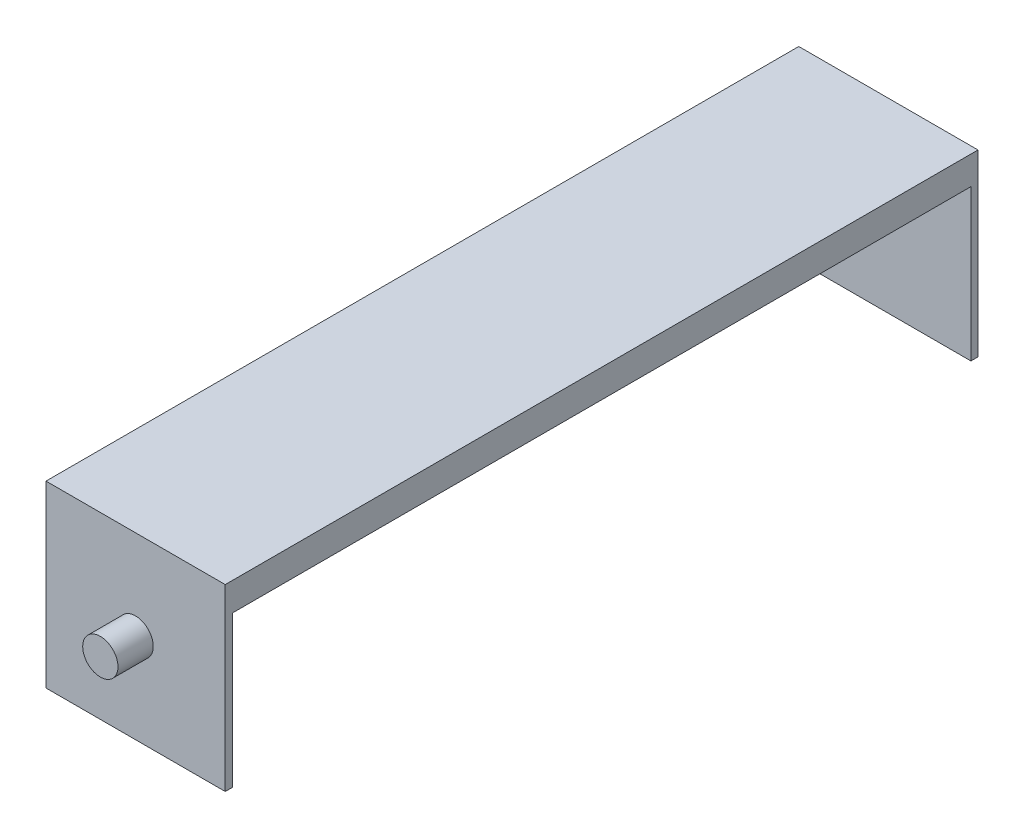
from build123d import *

# Parameters (mm, degrees)
SKETCH1_W           = 254
SKETCH1_H           = 254
BOSS_EXTRUDE1_DEPTH = 533.4
SKETCH2_R           = 25
BOSS_EXTRUDE2_DEPTH = 50
SKETCH3_W           = 1046.8
SKETCH3_H           = 267.639830062
CUT_EXTRUDE1_DEPTH  = 254


with BuildPart() as part:
    # Sketch1 → Boss-Extrude1 (new, symmetric)
    with BuildSketch(Plane.XY):
        Rectangle(SKETCH1_W, SKETCH1_H)
    extrude(amount=BOSS_EXTRUDE1_DEPTH, both=True)

    # Sketch2 → Boss-Extrude2 (add)
    with BuildSketch(Plane.XY.offset(533.4)):
        with Locations(Location((0, 0, 0), (0, 0, 180))):
            Circle(SKETCH2_R)
    boss_extrude2 = extrude(amount=BOSS_EXTRUDE2_DEPTH)

    # Mirror1: Boss-Extrude2 across plane
    add(boss_extrude2.mirror(Plane.XY))

    # Sketch3 → Cut-Extrude1 (cut)
    with BuildSketch(Plane(origin=(127, 0, 0), x_dir=(0, 0, -1), z_dir=(1, 0, 0))):
        with Locations((0, -46.819915031)):
            Rectangle(SKETCH3_W, SKETCH3_H)
    extrude(amount=-CUT_EXTRUDE1_DEPTH, mode=Mode.SUBTRACT)


solid = part.part
